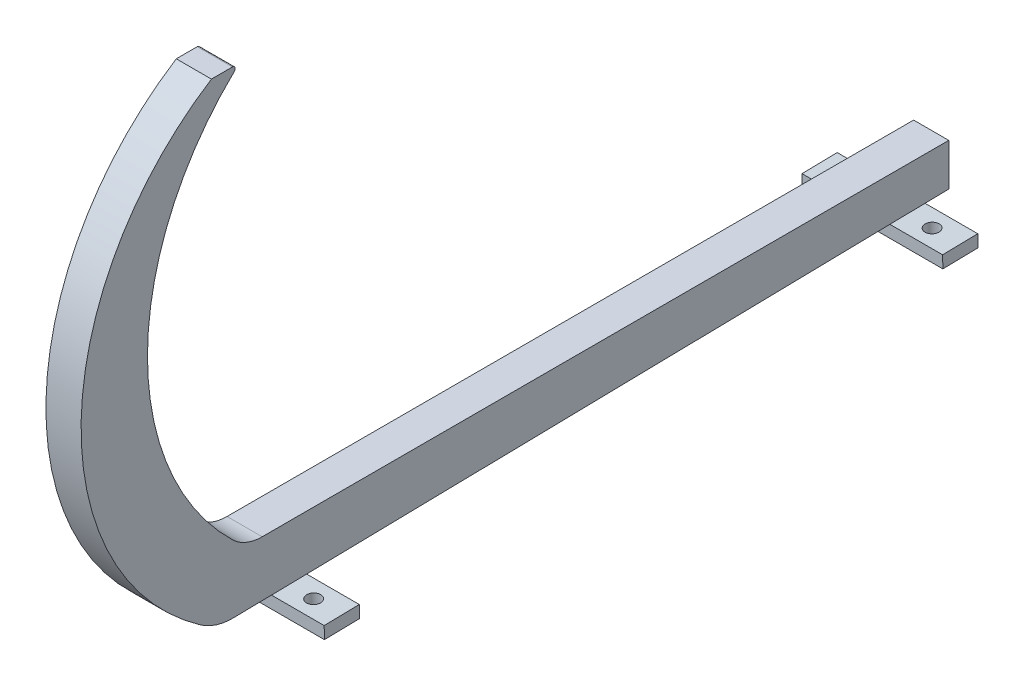
from build123d import *

# Parameters (mm, degrees)
BOSS_EXTRUDE1_DEPTH = 15.875
SKETCH2_W           = 127
SKETCH2_H           = 31.75
SKETCH2_R           = 6.35
BOSS_EXTRUDE2_DEPTH = 11.176
FILLET1_R           = 2.54


with BuildPart() as part:
    # Sketch1 → Boss-Extrude1 (new, symmetric)
    with BuildSketch(Plane(origin=(0, 0, 0), x_dir=(0, 0, -1), z_dir=(1, 0, 0))):
        with BuildLine():
            Line((317.5, 0), (-302.771488663, 0))
            ThreePointArc((-302.771488663, 0), (-317.088938009, 2.792484593), (-329.307633721, 10.760596103))
            ThreePointArc((-329.307633721, 10.760596103), (-406.365714437, 197.196523766), (-323.223757211, 381))
            Line((-323.223757211, 381), (-348.623757211, 381))
            ThreePointArc((-348.623757211, 381), (-466.315322723, 172.429486078), (-358.266662239, -41.295689879))
            ThreePointArc((-358.266662239, -41.295689879), (-343.922523577, -48.296611465), (-328.11404497, -50.500975578))
            Line((-328.11404497, -50.500975578), (317.5, -38.1))
            Line((317.5, -38.1), (317.5, 0))
        make_face()
    extrude(amount=BOSS_EXTRUDE1_DEPTH, both=True)

    # Sketch2 → Boss-Extrude2 (add)
    # profile 1 of 2: a face of its own
    with BuildSketch(Plane(origin=(0, -44.182249353, -0.848654083), x_dir=(1, 0, 0), z_dir=(0, -0.9998155767735977, -0.019204490122845825))):
        with Locations((0, 279.4)):
            Rectangle(SKETCH2_W, SKETCH2_H)
        with Locations(Location((38.1, 279.4, 0), (0, 0, 270))):
            Circle(SKETCH2_R, mode=Mode.SUBTRACT)
        with Locations(Location((-38.1, 279.4, 0), (0, 0, 270))):
            Circle(SKETCH2_R, mode=Mode.SUBTRACT)
    # profile 2 of 2: a face of its own
    with BuildSketch(Plane(origin=(0, -44.182249353, -0.848654083), x_dir=(1, 0, 0), z_dir=(0, -0.9998155767735977, -0.019204490122845825))):
        with Locations((0, -279.4)):
            Rectangle(SKETCH2_W, SKETCH2_H)
        with Locations(Location((-38.1, -279.4, 0), (0, 0, 90))):
            Circle(SKETCH2_R, mode=Mode.SUBTRACT)
        with Locations(Location((38.1, -279.4, 0), (0, 0, 90))):
            Circle(SKETCH2_R, mode=Mode.SUBTRACT)
    extrude(amount=BOSS_EXTRUDE2_DEPTH)

    # Fillet1
    fillet1_edges = [part.edges().sort_by_distance(p)[0] for p in [
        (0, 381, 323.223757211),
    ]]
    fillet(fillet1_edges, radius=FILLET1_R)


solid = part.part
